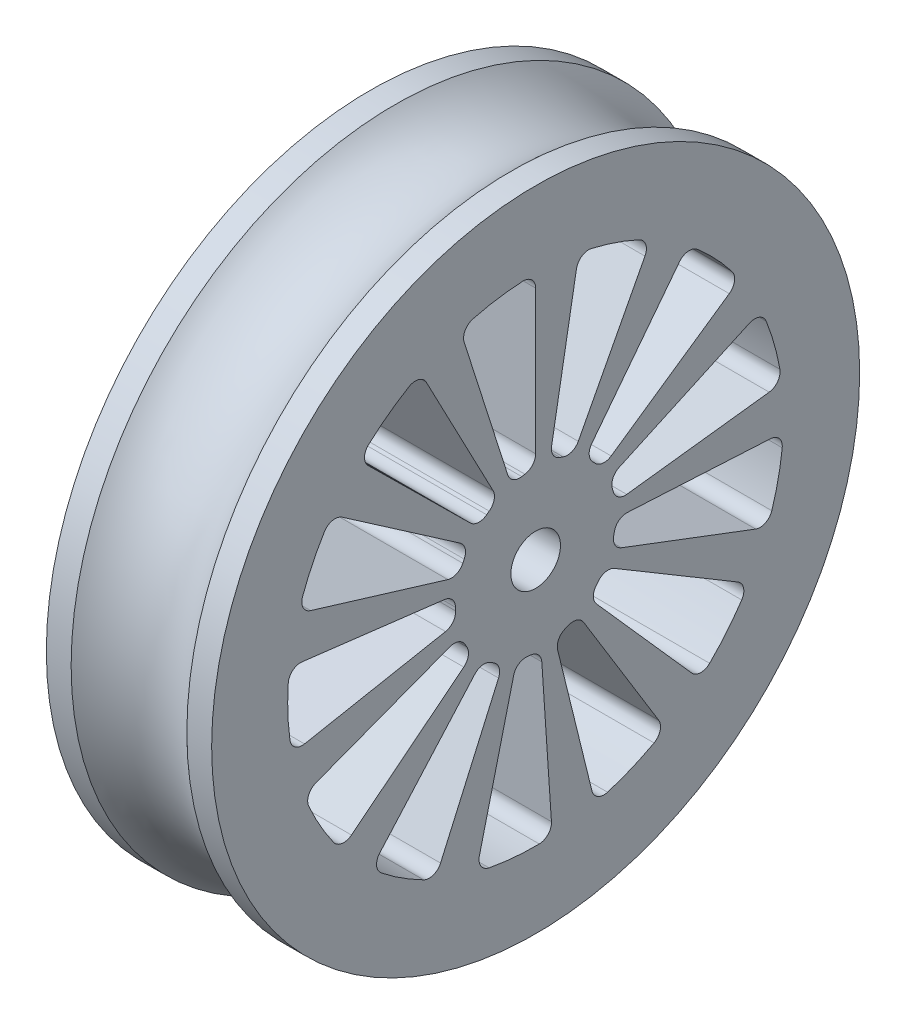
from build123d import *

# Parameters (mm, degrees)
CUT_EXTRUDE2_DEPTH      = 30.467269979
FILLET1_R               = 0.75
CUT_EXTRUDE3_DEPTH      = 30.467269979
CUT_EXTRUDE3_DEPTH_BACK = 30.467269979
SKETCH2_R               = 1.5


with BuildPart() as part:
    # Sketch1 → Revolve2 (revolve)
    with BuildSketch(Plane.XY, mode=Mode.PRIVATE) as revolve2_sk:
        with BuildLine():
            Line((0, 0), (10, 0))
            Line((10, 0), (10, 19.6))
            Line((10, 19.6), (8.5, 19.6))
            ThreePointArc((8.5, 19.6), (5, 18.170714214), (1.5, 19.6))
            Line((1.5, 19.6), (0, 19.6))
            Line((0, 19.6), (0, 0))
        make_face()
    revolve(revolve2_sk.sketch.rotate(Axis((0, 0, 0), (1, 0, 0)), 90), axis=Axis((0, 0, 0), (1, 0, 0)))

    # Sketch3 → Cut-Extrude2 (cut, through all)
    with BuildSketch(Plane(origin=(10, 0, 0), x_dir=(0, 0, -1), z_dir=(1, 0, 0))):
        with BuildLine():
            Line((2.604722665, 14.772116295), (0.84225046, 4.776639722))
            ThreePointArc((0.84225046, 4.776639722), (1.566792192, 4.590297931), (2.25405939, 4.294751347))
            Line((2.25405939, 4.294751347), (6.970847581, 13.281840385))
            ThreePointArc((6.970847581, 13.281840385), (4.845422268, 14.195840343), (2.604722665, 14.772116295))
        make_face()
        with BuildLine():
            Line((9.171312121, 11.869584406), (2.965590908, 3.838091119))
            ThreePointArc((2.965590908, 3.838091119), (3.520543403, 3.336382325), (3.991740938, 2.755299829))
            Line((3.991740938, 2.755299829), (12.344757988, 8.520971201))
            ThreePointArc((12.344757988, 8.520971201), (10.887544298, 10.318012365), (9.171312121, 11.869584406))
        make_face()
        with BuildLine():
            Line((13.636864497, 6.247873773), (4.409550218, 2.020282094))
            ThreePointArc((4.409550218, 2.020282094), (4.667780547, 1.318141736), (4.814962743, 0.584642325))
            Line((4.814962743, 0.584642325), (14.890633111, 1.808050204))
            ThreePointArc((14.890633111, 1.808050204), (14.435461139, 4.076452099), (13.636864497, 6.247873773))
        make_face()
        with BuildLine():
            Line((14.978375558, -0.805149446), (4.843334715, -0.260349211))
            ThreePointArc((4.843334715, -0.260349211), (4.74568542, -1.002069239), (4.53513461, -1.719949689))
            Line((4.53513461, -1.719949689), (14.02524364, -5.319073306))
            ThreePointArc((14.02524364, -5.319073306), (14.676387798, -3.098974216), (14.978375558, -0.805149446))
        make_face()
        with BuildLine():
            Line((12.888521288, -7.67372263), (4.167569596, -2.48133765))
            ThreePointArc((4.167569596, -2.48133765), (3.736410956, -3.092718228), (3.216361792, -3.630521958))
            Line((3.216361792, -3.630521958), (9.946839874, -11.227661223))
            ThreePointArc((9.946839874, -11.227661223), (11.555130883, -9.564462885), (12.888521288, -7.67372263))
        make_face()
        with BuildLine():
            Line((7.846062115, -12.784338438), (2.537064508, -4.133881536))
            ThreePointArc((2.537064508, -4.133881536), (1.87116977, -4.474862742), (1.160759249, -4.709385399))
            Line((1.160759249, -4.709385399), (3.589734964, -14.564127261))
            ThreePointArc((3.589734964, -14.564127261), (5.786732737, -13.838848371), (7.846062115, -12.784338438))
        make_face()
        with BuildLine():
            ThreePointArc((0.325348516, -4.839402981), (-0.42273386, -4.83187013), (-1.160759249, -4.709385399))
            Line((-1.160759249, -4.709385399), (-3.589734964, -14.564127261))
            ThreePointArc((-3.589734964, -14.564127261), (-1.307336141, -14.942920471), (1.006164666, -14.966216378))
            Line((1.006164666, -14.966216378), (0.325348516, -4.839402981))
        make_face()
        with BuildLine():
            ThreePointArc((-1.9609009, -4.436275524), (-2.619794257, -4.081954301), (-3.216361792, -3.630521958))
            Line((-3.216361792, -3.630521958), (-9.946839874, -11.227661223))
            ThreePointArc((-9.946839874, -11.227661223), (-8.101910065, -12.623749574), (-6.064232982, -13.719514508))
            Line((-6.064232982, -13.719514508), (-1.9609009, -4.436275524))
        make_face()
        with BuildLine():
            ThreePointArc((-3.797931552, -3.016850808), (-4.216691362, -2.396911935), (-4.53513461, -1.719949689))
            Line((-4.53513461, -1.719949689), (-14.02524364, -5.319073306))
            ThreePointArc((-14.02524364, -5.319073306), (-13.040434031, -7.412629781), (-11.745387936, -9.329837203))
            Line((-11.745387936, -9.329837203), (-3.797931552, -3.016850808))
        make_face()
        with BuildLine():
            ThreePointArc((-4.764901855, -0.906301928), (-4.847595293, -0.162765931), (-4.814962743, 0.584642325))
            Line((-4.814962743, 0.584642325), (-14.890633111, 1.808050204))
            ThreePointArc((-14.890633111, 1.808050204), (-14.991551715, -0.503365838), (-14.735816061, -2.802806631))
            Line((-14.735816061, -2.802806631), (-4.764901855, -0.906301928))
        make_face()
        with BuildLine():
            ThreePointArc((-4.640290566, 1.411869801), (-4.367973561, 2.108667787), (-3.991740938, 2.755299829))
            Line((-3.991740938, 2.755299829), (-12.344757988, 8.520971201))
            ThreePointArc((-12.344757988, 8.520971201), (-13.508285569, 6.521213153), (-14.350446312, 4.366313163))
            Line((-14.350446312, 4.366313163), (-4.640290566, 1.411869801))
        make_face()
        with BuildLine():
            ThreePointArc((-3.45264463, 3.406599173), (-2.887701727, 3.897031127), (-2.25405939, 4.294751347))
            Line((-2.25405939, 4.294751347), (-6.970847581, 13.281840385))
            ThreePointArc((-6.970847581, 13.281840385), (-8.930433992, 12.051860799), (-10.677562255, 10.53516323))
            Line((-10.677562255, 10.53516323), (-3.45264463, 3.406599173))
        make_face()
        with BuildLine():
            ThreePointArc((-1.474039418, 4.620917729), (-0.745892228, 4.7926316), (0, 4.850327089))
            Line((0, 4.850327089), (0, 15))
            ThreePointArc((0, 15), (-2.30672761, 14.821572377), (-4.558577364, 14.290534364))
            Line((-4.558577364, 14.290534364), (-1.474039418, 4.620917729))
        make_face()
    extrude(amount=-CUT_EXTRUDE2_DEPTH, mode=Mode.SUBTRACT)

    # Fillet1
    fillet1_edges = [part.edges().sort_by_distance(p)[0] for p in [
        (5, -11.227661223, -9.946839874),
        (5, 2.755299829, -3.991740938),
        (5, 3.838091119, -2.965590908),
        (5, 11.869584406, -9.171312121),
        (5, 8.520971201, -12.344757988),
        (5, 0.584642325, -4.814962743),
        (5, 2.020282094, -4.409550218),
        (5, 6.247873773, -13.636864497),
        (5, 1.808050204, -14.890633111),
        (5, 4.294751347, 2.25405939),
        (5, 3.406599173, 3.45264463),
        (5, 10.53516323, 10.677562255),
        (5, 13.281840385, 6.970847581),
        (5, 4.850327089, 0),
        (5, 4.620917729, 1.474039418),
        (5, 14.290534364, 4.558577364),
        (5, 15, 0),
        (5, 0.584642325, 4.814962743),
        (5, -0.906301928, 4.764901855),
        (5, -2.802806631, 14.735816061),
        (5, 1.808050204, 14.890633111),
        (5, 2.755299829, 3.991740938),
        (5, 1.411869801, 4.640290566),
        (5, 4.366313163, 14.350446312),
        (5, 8.520971201, 12.344757988),
        (5, 4.294751347, -2.25405939),
        (5, 4.776639722, -0.84225046),
        (5, 14.772116295, -2.604722665),
        (5, 13.281840385, -6.970847581),
        (5, -4.709385399, -1.160759249),
        (5, -4.133881536, -2.537064508),
        (5, -12.784338438, -7.846062115),
        (5, -14.564127261, -3.589734964),
        (5, -4.709385399, 1.160759249),
        (5, -4.839402981, -0.325348516),
        (5, -14.966216378, -1.006164666),
        (5, -14.564127261, 3.589734964),
        (5, -1.719949689, 4.53513461),
        (5, -3.016850808, 3.797931552),
        (5, -9.329837203, 11.745387936),
        (5, -5.319073306, 14.02524364),
        (5, -3.630521958, 3.216361792),
        (5, -4.436275524, 1.9609009),
        (5, -13.719514508, 6.064232982),
        (5, -11.227661223, 9.946839874),
        (5, -1.719949689, -4.53513461),
        (5, -0.260349211, -4.843334715),
        (5, -0.805149446, -14.978375558),
        (5, -5.319073306, -14.02524364),
        (5, -3.630521958, -3.216361792),
        (5, -2.48133765, -4.167569596),
        (5, -7.67372263, -12.888521288),
    ]]
    fillet(fillet1_edges, radius=FILLET1_R)

    # Sketch2 → Cut-Extrude3 (cut, two sides: drawn at the far end of the back side and taken through both)
    with BuildSketch(Plane(origin=(10, 0, 0), x_dir=(0, 0, -1), z_dir=(1, 0, 0)).offset(-CUT_EXTRUDE3_DEPTH_BACK)):
        Circle(SKETCH2_R)
    extrude(amount=CUT_EXTRUDE3_DEPTH + CUT_EXTRUDE3_DEPTH_BACK, mode=Mode.SUBTRACT)


solid = part.part
